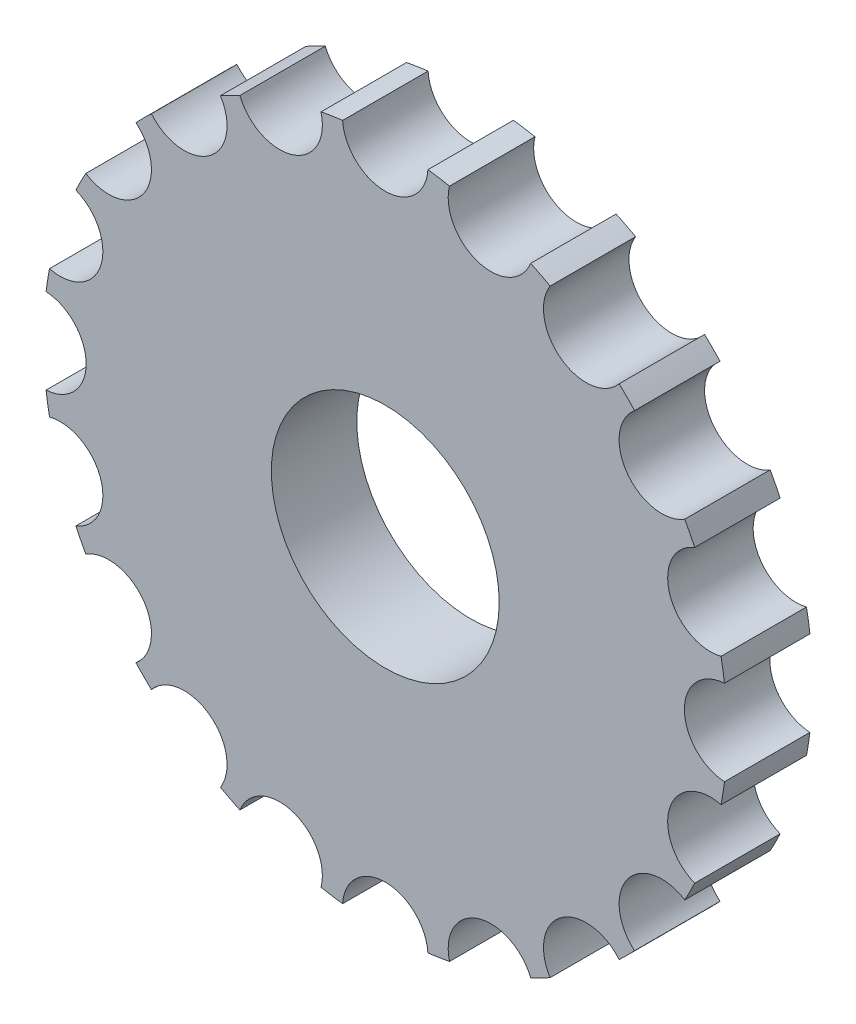
from build123d import *

# Parameters (mm, degrees)
SKETCH1_R           = 60
SKETCH1_R_2         = 20
BOSS_EXTRUDE1_DEPTH = 15
SKETCH2_R           = 7.5
CUT_EXTRUDE1_DEPTH  = 15


with BuildPart() as part:
    # Sketch1 → Boss-Extrude1 (new body)
    with BuildSketch(Plane.XY):
        Circle(SKETCH1_R)
        Circle(SKETCH1_R_2, mode=Mode.SUBTRACT)
    extrude(amount=BOSS_EXTRUDE1_DEPTH)

    # Sketch2 → Cut-Extrude1 (cut)
    with BuildSketch(Plane.XY.offset(15)):
        with Locations((0, 60)):
            Circle(SKETCH2_R)
        with Locations((18.541019662, 57.063390978)):
            Circle(SKETCH2_R)
        with Locations((35.267115138, 48.541019663)):
            Circle(SKETCH2_R)
        with Locations((48.541019663, 35.267115138)):
            Circle(SKETCH2_R)
        with Locations((57.063390978, 18.541019663)):
            Circle(SKETCH2_R)
        with Locations((60, 0)):
            Circle(SKETCH2_R)
        with Locations((57.063390978, -18.541019662)):
            Circle(SKETCH2_R)
        with Locations((48.541019663, -35.267115138)):
            Circle(SKETCH2_R)
        with Locations((35.267115138, -48.541019662)):
            Circle(SKETCH2_R)
        with Locations((18.541019663, -57.063390978)):
            Circle(SKETCH2_R)
        with Locations((0, -60)):
            Circle(SKETCH2_R)
        with Locations((-18.541019662, -57.063390978)):
            Circle(SKETCH2_R)
        with Locations((-35.267115138, -48.541019663)):
            Circle(SKETCH2_R)
        with Locations((-48.541019662, -35.267115138)):
            Circle(SKETCH2_R)
        with Locations((-57.063390978, -18.541019663)):
            Circle(SKETCH2_R)
        with Locations((-60, 0)):
            Circle(SKETCH2_R)
        with Locations((-57.063390978, 18.541019662)):
            Circle(SKETCH2_R)
        with Locations((-48.541019662, 35.267115138)):
            Circle(SKETCH2_R)
        with Locations((-35.267115138, 48.541019662)):
            Circle(SKETCH2_R)
        with Locations((-18.541019662, 57.063390978)):
            Circle(SKETCH2_R)
    extrude(amount=-CUT_EXTRUDE1_DEPTH, mode=Mode.SUBTRACT)


solid = part.part
